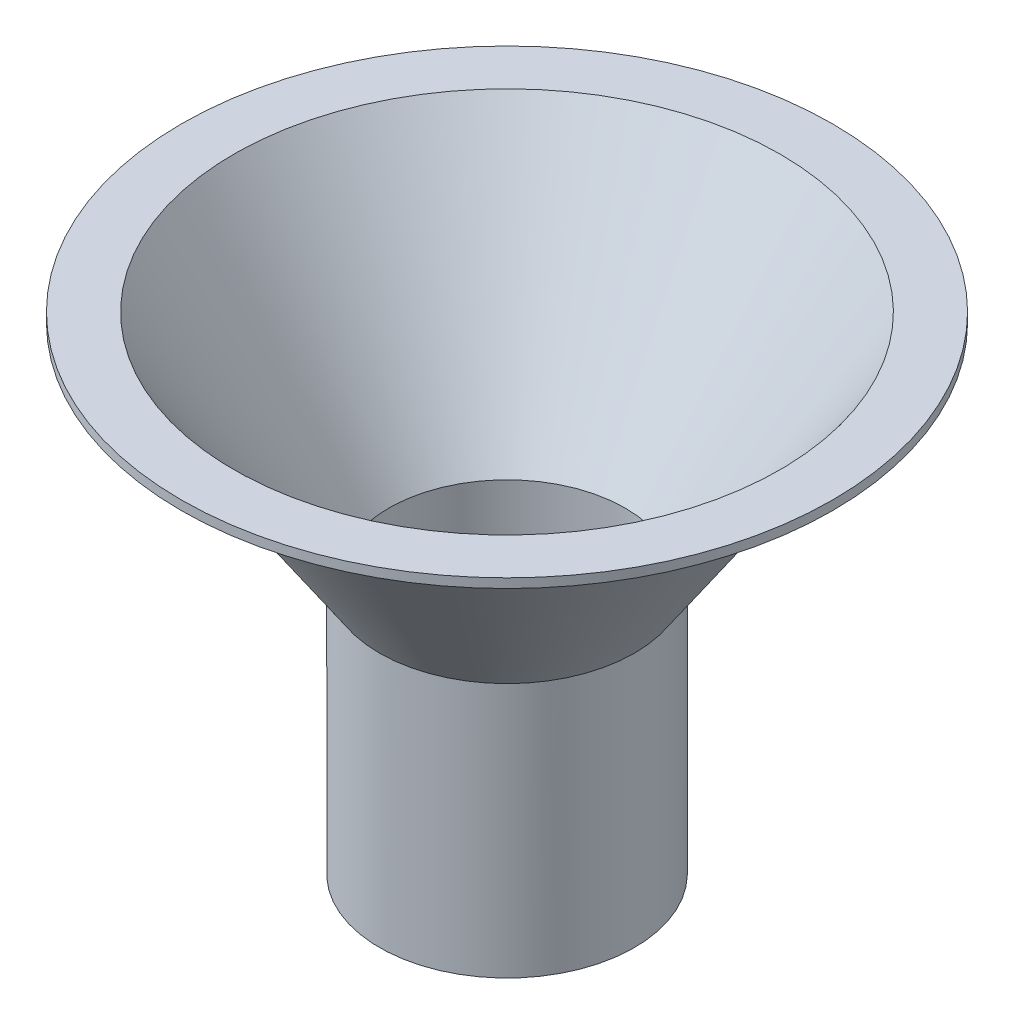
from build123d import *

# Parameters (mm, degrees)
SKETCH4_W = 0.9
SKETCH4_H = 0.8


with BuildPart() as part:
    # Sketch3 → Revolve3 (revolve)
    with BuildSketch(Plane.XY, mode=Mode.PRIVATE) as revolve3_sk:
        Polygon((-11, -44), (-10.2, -44), (-10.2, -21.754642132), (-23.575538943, -2), (-29, -2), (-29, -2.8), (-28, -2.8), (-28, -3.8), (-21.291666667, -6.8), (-11, -22), align=None)
    revolve(revolve3_sk.sketch.rotate(Axis((0, 0, 0), (0, 1, 0)), 270), axis=Axis((0, 0, 0), (0, 1, 0)))

    # Sketch4 → Cut-Revolve1 (revolve, cut)
    with BuildSketch(Plane.XY, mode=Mode.PRIVATE) as cut_revolve1_sk:
        with Locations((-28.55, -2.4)):
            Rectangle(SKETCH4_W, SKETCH4_H)
    revolve(cut_revolve1_sk.sketch.rotate(Axis((0, 0, 0), (0, -1, 0)), 270), axis=Axis((0, 0, 0), (0, -1, 0)), mode=Mode.SUBTRACT)

    # Sketch5 → Cut-Revolve2 (revolve, cut)
    with BuildSketch(Plane.XY, mode=Mode.PRIVATE) as cut_revolve2_sk:
        Polygon((-21.291666667, -6.8), (-28, -3.8), (-28, -2.8), align=None)
    revolve(cut_revolve2_sk.sketch.rotate(Axis((0, 0, 0), (0, -1, 0)), 270), axis=Axis((0, 0, 0), (0, -1, 0)), mode=Mode.SUBTRACT)


solid = part.part
